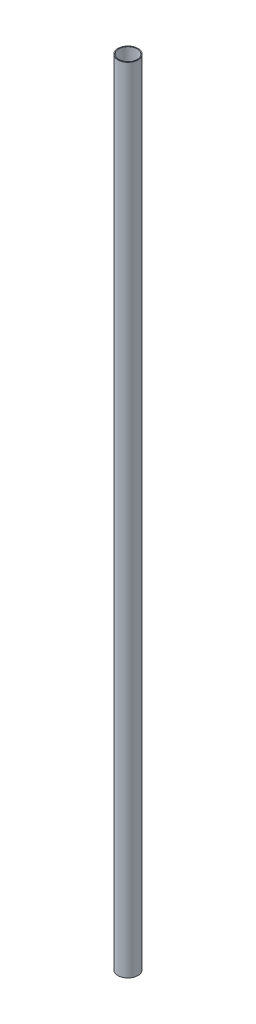
from build123d import *

# Parameters (mm, degrees)
SKETCH2_R           = 16.381543329
SKETCH2_R_2         = 15
BOSS_EXTRUDE1_DEPTH = 1296.55504832


with BuildPart() as part:
    # Sketch2 → Boss-Extrude1 (new body)
    with BuildSketch(Plane(origin=(0, 0, 0), x_dir=(1, 0, 0), z_dir=(0, 1, 0))):
        with Locations(Location((0, 0, 0), (0, 0, 270))):
            Circle(SKETCH2_R)
        with Locations(Location((0, 0, 0), (0, 0, 270))):
            Circle(SKETCH2_R_2, mode=Mode.SUBTRACT)
    extrude(amount=BOSS_EXTRUDE1_DEPTH)


solid = part.part
